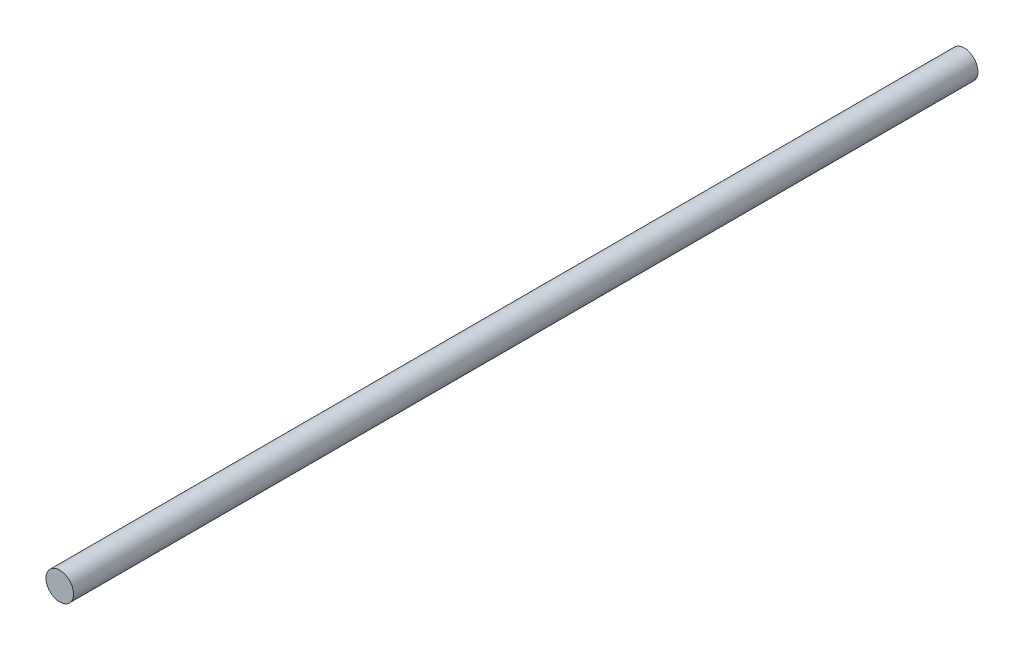
from build123d import *

# Parameters (mm, degrees)
SKETCH_1_R           = 3
CABLE_ENVELOPE_DEPTH = 196.936087348


with BuildPart() as part:
    # 草图1 → Cable_envelope (new body)
    with BuildSketch(Plane.XY):
        Circle(SKETCH_1_R)
    extrude(amount=CABLE_ENVELOPE_DEPTH)


solid = part.part
